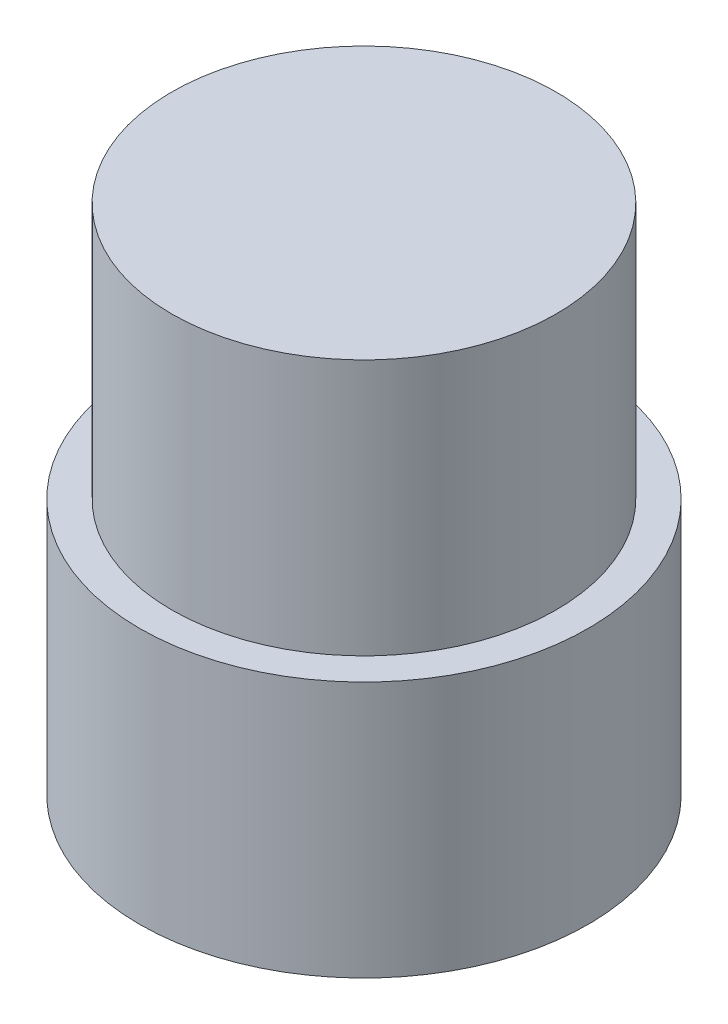
from build123d import *

# Parameters (mm, degrees)
SKETCH2_R           = 1.75
BOSS_EXTRUDE1_DEPTH = 2
SKETCH3_R           = 1.5
BOSS_EXTRUDE2_DEPTH = 2


with BuildPart() as part:
    # Sketch2 → Boss-Extrude1 (new body)
    with BuildSketch(Plane(origin=(0, 0, 0), x_dir=(1, 0, 0), z_dir=(0, 1, 0))):
        with Locations(Location((0, 0, 0), (0, 0, 270))):
            Circle(SKETCH2_R)
    extrude(amount=BOSS_EXTRUDE1_DEPTH)

    # Sketch3 → Boss-Extrude2 (add)
    with BuildSketch(Plane(origin=(0, 2, 0), x_dir=(1, 0, 0), z_dir=(0, 1, 0))):
        with Locations(Location((0, 0, 0), (0, 0, 270))):
            Circle(SKETCH3_R)
    extrude(amount=BOSS_EXTRUDE2_DEPTH)


solid = part.part
